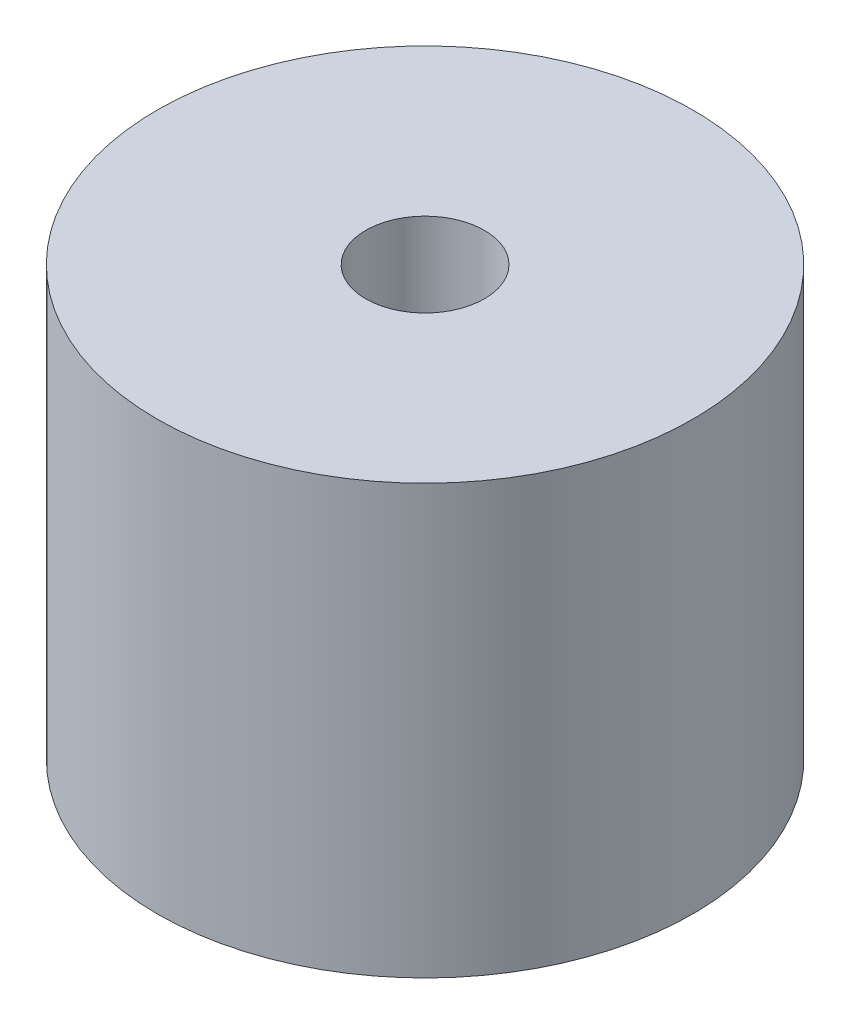
from build123d import *

# Parameters (mm, degrees)
SKETCH1_R           = 6
BOSS_EXTRUDE1_DEPTH = 9.6
SKETCH2_R           = 1.33
CUT_EXTRUDE1_DEPTH  = 3
SKETCH3_R           = 5
CUT_EXTRUDE2_DEPTH  = 1
SKETCH4_R           = 0.3
BOSS_EXTRUDE2_DEPTH = 1


with BuildPart() as part:
    # Sketch1 → Boss-Extrude1 (new body)
    with BuildSketch(Plane(origin=(0, 0, 0), x_dir=(1, 0, 0), z_dir=(0, 1, 0))):
        with Locations(Location((0, 0, 0), (0, 0, 270))):
            Circle(SKETCH1_R)
    extrude(amount=BOSS_EXTRUDE1_DEPTH)

    # Sketch2 → Cut-Extrude1 (cut)
    with BuildSketch(Plane(origin=(0, 9.6, 0), x_dir=(1, 0, 0), z_dir=(0, 1, 0))):
        with Locations(Location((0, 0, 0), (0, 0, 270))):
            Circle(SKETCH2_R)
    extrude(amount=-CUT_EXTRUDE1_DEPTH, mode=Mode.SUBTRACT)

    # Sketch3 → Cut-Extrude2 (cut)
    with BuildSketch(Plane(origin=(0, 6.6, 0), x_dir=(1, 0, 0), z_dir=(0, 1, 0))):
        with Locations(Location((0, 0, 0), (0, 0, 270))):
            Circle(SKETCH3_R)
    extrude(amount=CUT_EXTRUDE2_DEPTH, mode=Mode.SUBTRACT)

    # Sketch4 → Boss-Extrude2 (add)
    with BuildSketch(Plane.XZ):
        with Locations(Location((-3.75, 0, 0), (0, 0, 90))):
            Circle(SKETCH4_R)
        with Locations(Location((3.75, 0, 0), (0, 0, 90))):
            Circle(SKETCH4_R)
    extrude(amount=BOSS_EXTRUDE2_DEPTH)


solid = part.part
